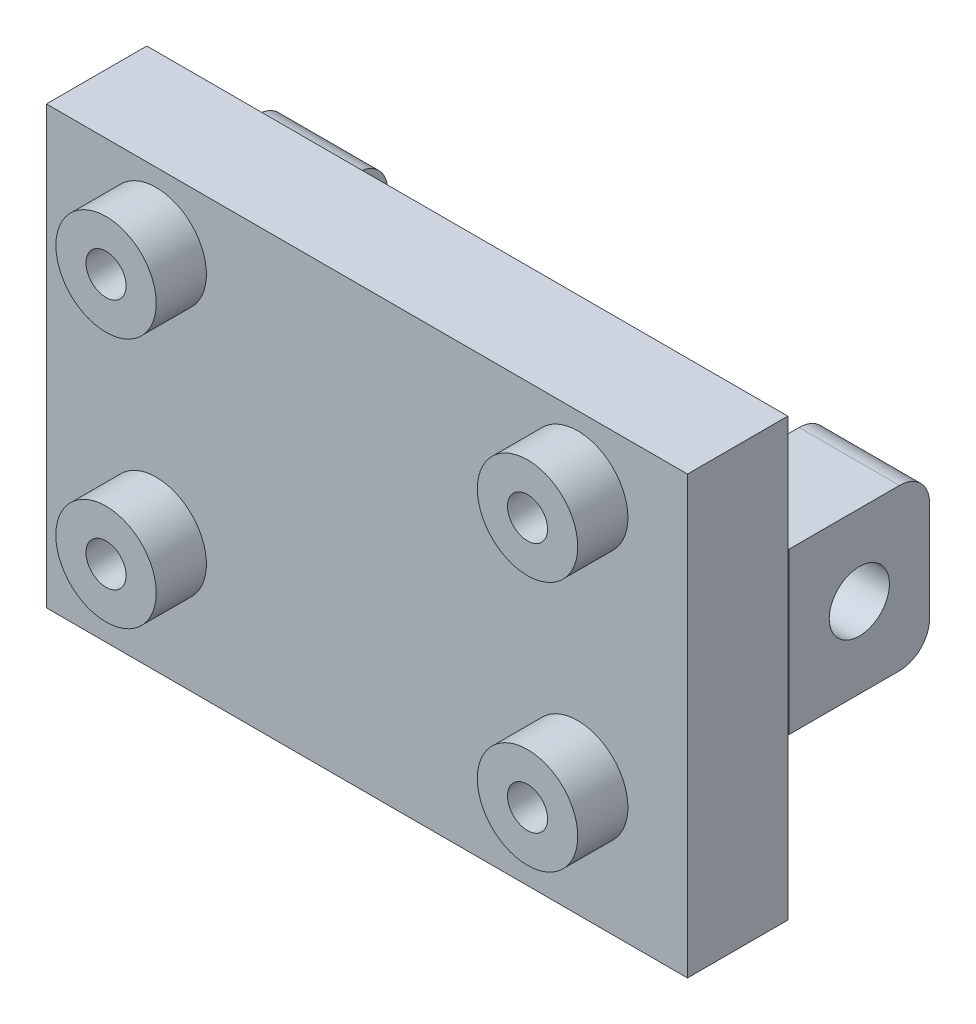
from build123d import *

# Parameters (mm, degrees)
ESQUISSE1_W                = 31.939489742
ESQUISSE1_H                = 21.744204364
ESQUISSE1_R                = 1
BOSS_EXTRU_1_DEPTH         = 5
ESQUISSE2_R                = 2.5
ESQUISSE2_R_2              = 1
BOSS_EXTRU_2_DEPTH         = 2.5
ESQUISSE4_R                = 1.5
BOSS_EXTRU_3_DEPTH         = 5
R_P_TITION_LIN_AIRE1_COUNT = 2
R_P_TITION_LIN_AIRE1_PITCH = 27


with BuildPart() as part:
    # Esquisse1 → Boss.-Extru.1 (new body)
    with BuildSketch(Plane.XY):
        with Locations((0, -1.253300442)):
            Rectangle(ESQUISSE1_W, ESQUISSE1_H)
        with Locations((10.5, 6.25)):
            Circle(ESQUISSE1_R, mode=Mode.SUBTRACT)
        with Locations((10.5, -6.25)):
            Circle(ESQUISSE1_R, mode=Mode.SUBTRACT)
        with Locations((-10.5, -6.25)):
            Circle(ESQUISSE1_R, mode=Mode.SUBTRACT)
        with Locations((-10.5, 6.25)):
            Circle(ESQUISSE1_R, mode=Mode.SUBTRACT)
    extrude(amount=BOSS_EXTRU_1_DEPTH)

    # Esquisse2 → Boss.-Extru.2 (add)
    # profile 1 of 4: a face of its own
    with BuildSketch(Plane.XY.offset(5)):
        with Locations(Location((-10.5, 6.25, 0), (0, 0, 180))):
            Circle(ESQUISSE2_R)
        with Locations((-10.5, 6.25)):
            Circle(ESQUISSE2_R_2, mode=Mode.SUBTRACT)
    # profile 2 of 4: a face of its own
    with BuildSketch(Plane.XY.offset(5)):
        with Locations(Location((10.5, 6.25, 0), (0, 0, 180))):
            Circle(ESQUISSE2_R)
        with Locations((10.5, 6.25)):
            Circle(ESQUISSE2_R_2, mode=Mode.SUBTRACT)
    # profile 3 of 4: a face of its own
    with BuildSketch(Plane.XY.offset(5)):
        with Locations(Location((10.5, -6.25, 0), (0, 0, 180))):
            Circle(ESQUISSE2_R)
        with Locations((10.5, -6.25)):
            Circle(ESQUISSE2_R_2, mode=Mode.SUBTRACT)
    # profile 4 of 4: a face of its own
    with BuildSketch(Plane.XY.offset(5)):
        with Locations(Location((-10.5, -6.25, 0), (0, 0, 180))):
            Circle(ESQUISSE2_R)
        with Locations((-10.5, -6.25)):
            Circle(ESQUISSE2_R_2, mode=Mode.SUBTRACT)
    extrude(amount=BOSS_EXTRU_2_DEPTH)

    # Esquisse4 → Boss.-Extru.3 (add)
    with BuildSketch(Plane.ZY.offset(15.969744871)):
        with BuildLine():
            Line((0, -4.091257207), (-5.5, -4.091257207))
            ThreePointArc((-5.5, -4.091257207), (-6.560660172, -3.651917379), (-7, -2.591257207))
            Line((-7, -2.591257207), (-7, 2.408742793))
            ThreePointArc((-7, 2.408742793), (-6.560660172, 3.469402965), (-5.5, 3.908742793))
            Line((-5.5, 3.908742793), (0, 3.908742793))
            Line((0, 3.908742793), (0, -4.091257207))
        make_face()
        with Locations((-3.5, -0.091257207)):
            Circle(ESQUISSE4_R, mode=Mode.SUBTRACT)
    boss_extru_3 = extrude(amount=-BOSS_EXTRU_3_DEPTH)

    # Répétition linéaire1: Boss.-Extru.3 ×2
    with Locations(*[(i * R_P_TITION_LIN_AIRE1_PITCH, 0, 0) for i in range(1, R_P_TITION_LIN_AIRE1_COUNT)]):
        add(boss_extru_3)


solid = part.part
